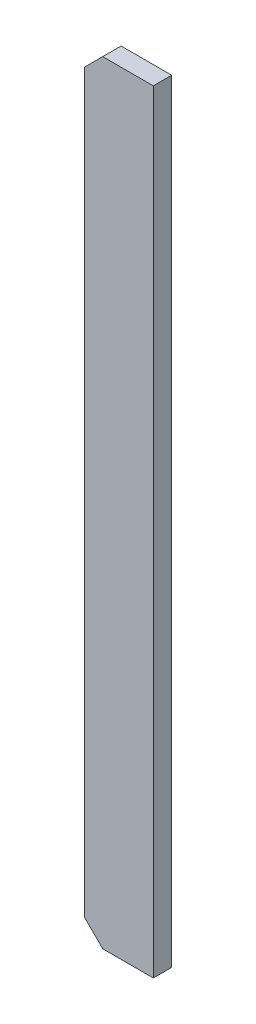
from build123d import *

# Parameters (mm, degrees)
SKETCH1_W           = 47.625
SKETCH1_H           = 533.4
BOSS_EXTRUDE1_DEPTH = 12.7
CHAMFER1_SIZE       = 12.7


with BuildPart() as part:
    # Sketch1 → Boss-Extrude1 (new body)
    with BuildSketch(Plane.XY):
        with Locations((-26.9875, 266.7)):
            Rectangle(SKETCH1_W, SKETCH1_H)
    extrude(amount=BOSS_EXTRUDE1_DEPTH)

    # Chamfer1
    chamfer1_edges = [part.edges().sort_by_distance(p)[0] for p in [
        (-50.8, 533.4, 6.35),
        (-50.8, 0, 6.35),
    ]]
    chamfer(chamfer1_edges, length=CHAMFER1_SIZE)


solid = part.part
